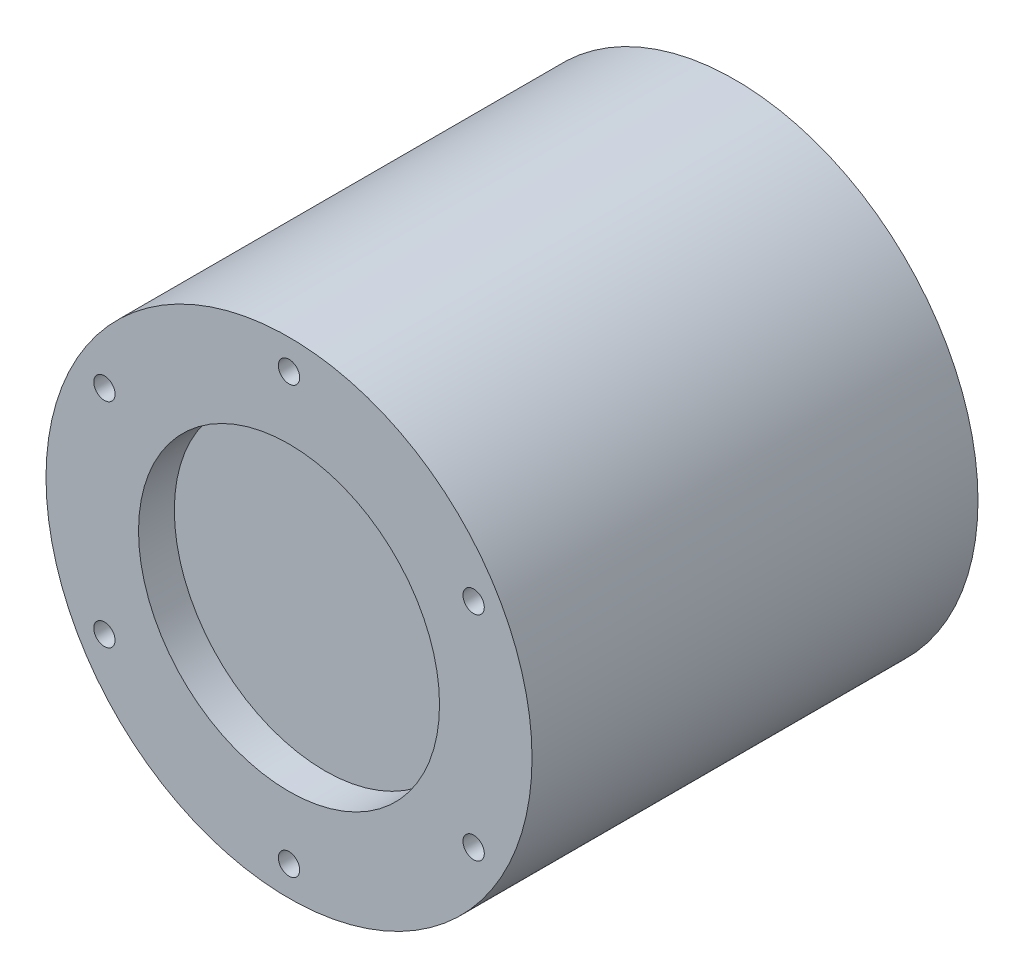
from build123d import *

# Parameters (mm, degrees)
STATOR_ENVELOPE_START     = -53.3
PROFILE_1_R               = 28.5
PROFILE_1_R_2             = 1.25
STATOR_ENVELOPE_DEPTH     = 52.3
ROTOR_REVIEW_RECESS_START = -5.2
PROFILE_2_R               = 17.65
ROTOR_REVIEW_RECESS_DEPTH = 4.3


with BuildPart() as part:
    # Profile_1 → Stator_envelope (new body)
    with BuildSketch(Plane.XY.offset(STATOR_ENVELOPE_START)):
        Circle(PROFILE_1_R)
        with Locations((21.650635095, 12.5)):
            Circle(PROFILE_1_R_2, mode=Mode.SUBTRACT)
        with Locations((0, 25)):
            Circle(PROFILE_1_R_2, mode=Mode.SUBTRACT)
        with Locations((-21.650635095, 12.5)):
            Circle(PROFILE_1_R_2, mode=Mode.SUBTRACT)
        with Locations((-21.650635095, -12.5)):
            Circle(PROFILE_1_R_2, mode=Mode.SUBTRACT)
        with Locations((0, -25)):
            Circle(PROFILE_1_R_2, mode=Mode.SUBTRACT)
        with Locations((21.650635095, -12.5)):
            Circle(PROFILE_1_R_2, mode=Mode.SUBTRACT)
    extrude(amount=STATOR_ENVELOPE_DEPTH)

    # Profile_2 → Rotor_review_recess (cut)
    with BuildSketch(Plane.XY.offset(ROTOR_REVIEW_RECESS_START)):
        with Locations(Location((0, 0, 0), (0, 0, 180))):
            Circle(PROFILE_2_R)
    extrude(amount=ROTOR_REVIEW_RECESS_DEPTH, mode=Mode.SUBTRACT)


solid = part.part
